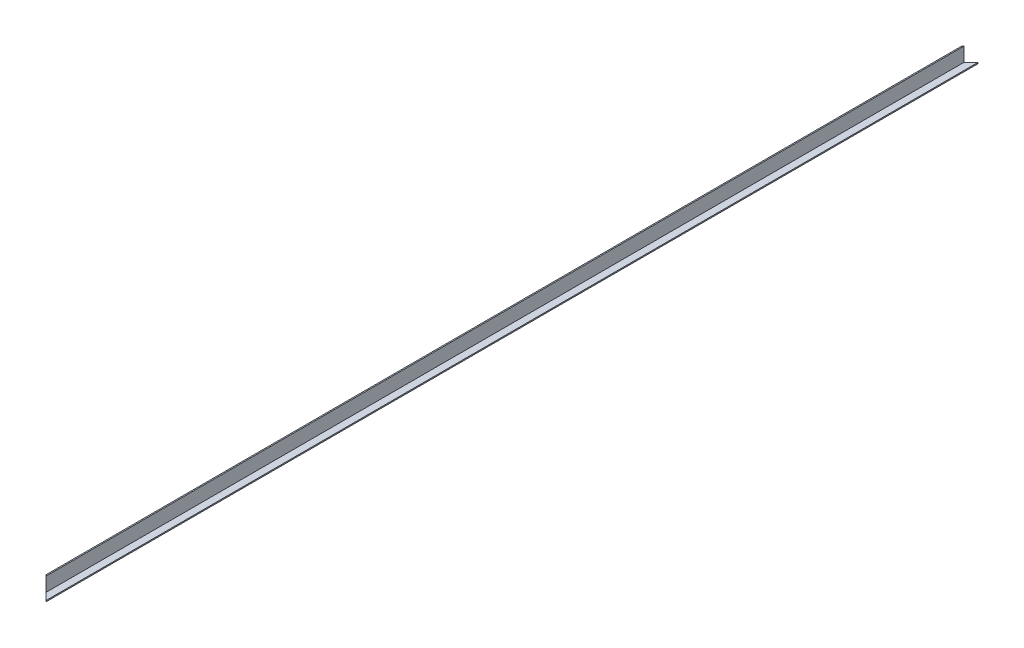
from build123d import *

# Parameters (mm, degrees)
BOSS_EXTRUDE1_DEPTH     = 1190
CUT_EXTRUDE1_DEPTH      = 1191.176063656
CUT_EXTRUDE1_DEPTH_BACK = 1191.176063656


with BuildPart() as part:
    # Sketch1 → Boss-Extrude1 (new body)
    with BuildSketch(Plane.XY):
        Polygon((-9.75, -9.75), (9.75, -9.75), (9.75, -8.25), (0.75, -8.25), (0.75, 9.75), (-0.75, 9.75), (-0.75, -8.25), (-9.75, -8.25), align=None)
    extrude(amount=BOSS_EXTRUDE1_DEPTH)

    # Sketch2 → Cut-Extrude1 (cut, two sides: drawn at the far end of the back side and taken through both)
    with BuildSketch(Plane(origin=(0, -8.25, 0), x_dir=(1, 0, 0), z_dir=(0, 1, 0)).offset(-CUT_EXTRUDE1_DEPTH_BACK)):
        Polygon((9.75, 0), (-9.75, -19.5), (-15.874453794, -19.5), (-15.874453794, 8.440692937), (9.75, 8.440692937), align=None)
        Polygon((9.75, -1190), (-9.75, -1170.5), (-13.500903001, -1170.5), (-13.500903001, -1195.414043503), (9.75, -1195.414043503), align=None)
    extrude(amount=CUT_EXTRUDE1_DEPTH + CUT_EXTRUDE1_DEPTH_BACK, mode=Mode.SUBTRACT)


solid = part.part
